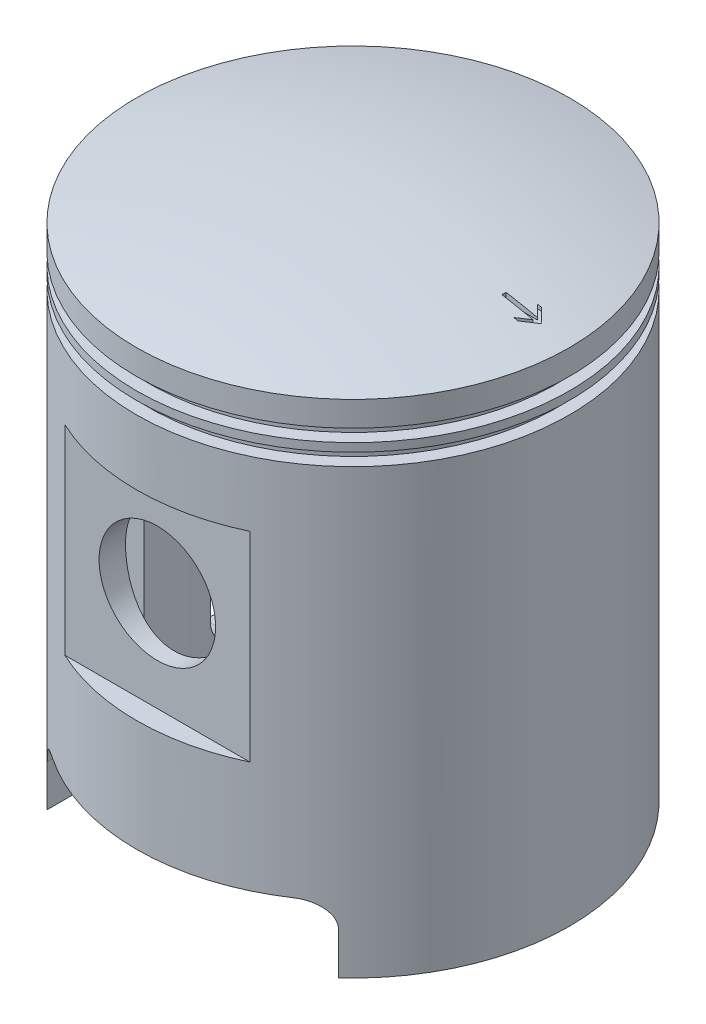
from build123d import *

# Parameters (mm, degrees)
SKETCH_1_R          = 26
EXTRUDE_1_DEPTH     = 60.2
SKETCH_3_R          = 7
CUT_EXTRUDE_1_DEPTH = 30.1
SKETCH_4_R          = 21.5
CUT_EXTRUDE_2_DEPTH = 51
SKETCH_5_W          = 1.5
SKETCH_5_H          = 1.5
CUT_EXTRUDE_3_DEPTH = 50
SKETCH_9_W          = 5.5
SKETCH_9_H          = 24
CUT_EXTRUDE_4_DEPTH = 25
CUT_EXTRUDE_5_DEPTH = 2.1


with BuildPart() as part:
    # Эскиз1 → Бобышка-Вытянуть1 (new body)
    with BuildSketch(Plane(origin=(0, 0, 0), x_dir=(1, 0, 0), z_dir=(0, 1, 0))):
        with Locations(Location((0, 0, 0), (0, 0, 270))):
            Circle(SKETCH_1_R)
    extrude(amount=EXTRUDE_1_DEPTH)

    # Эскиз2 → Повернуть1 (revolve)
    with BuildSketch(Plane.XY):
        with BuildLine():
            Line((26, 60.2), (0, 60.2))
            Line((0, 60.2), (0, 63.5))
            ThreePointArc((0, 63.5), (13.10429319, 62.671703918), (26, 60.2))
        make_face()
    revolve(axis=Axis((0, 60.2, 0), (0, 1, 0)))

    # Эскиз3 → Вырез-Вытянуть1 (cut, symmetric)
    with BuildSketch(Plane.XY):
        with Locations((0, 33.4)):
            Circle(SKETCH_3_R)
        with BuildLine():
            Line((17.5, 0), (-17.5, 0))
            Line((-17.5, 0), (-17.5, 5))
            ThreePointArc((-17.5, 5), (-16.621320344, 7.121320344), (-14.5, 8))
            Line((-14.5, 8), (14.5, 8))
            ThreePointArc((14.5, 8), (16.621320344, 7.121320344), (17.5, 5))
            Line((17.5, 5), (17.5, 0))
        make_face()
    extrude(amount=CUT_EXTRUDE_1_DEPTH, both=True, mode=Mode.SUBTRACT)

    # Эскиз4 → Вырез-Вытянуть2 (cut)
    with BuildSketch(Plane(origin=(0, 0, 0), x_dir=(1, 0, 0), z_dir=(0, 1, 0))):
        with Locations(Location((0, 0, 0), (0, 0, 47.590982222))):
            Circle(SKETCH_4_R)
    extrude(amount=CUT_EXTRUDE_2_DEPTH, mode=Mode.SUBTRACT)

    # Эскиз5 → Вырез-Повернуть1 (revolve, cut)
    with BuildSketch(Plane.XY, mode=Mode.PRIVATE) as cut_revolve_1_sk:
        with Locations((-25.25, 56.45)):
            Rectangle(SKETCH_5_W, SKETCH_5_H)
        with Locations((-25.25, 53.95)):
            Rectangle(SKETCH_5_W, SKETCH_5_H)
    revolve(cut_revolve_1_sk.sketch.rotate(Axis((0, 37.032198444, 0), (0, 1, 0)), 270), axis=Axis((0, 37.032198444, 0), (0, 1, 0)), mode=Mode.SUBTRACT)

    # Эскиз6 → Вырез-Вытянуть3 (cut)
    with BuildSketch(Plane(origin=(0, 0, 0), x_dir=(0, 0, -1), z_dir=(1, 0, 0))):
        with BuildLine():
            Line((-4, 6), (-4, 25))
            ThreePointArc((-4, 25), (-4.878679656, 27.121320344), (-7, 28))
            Line((-7, 28), (-10, 28))
            ThreePointArc((-10, 28), (-12.121320344, 27.121320344), (-13, 25))
            Line((-13, 25), (-13, 6))
            ThreePointArc((-13, 6), (-12.121320344, 3.878679656), (-10, 3))
            Line((-10, 3), (-7, 3))
            ThreePointArc((-7, 3), (-4.878679656, 3.878679656), (-4, 6))
        make_face()
        with BuildLine():
            Line((10, 3), (7, 3))
            ThreePointArc((7, 3), (4.878679656, 3.878679656), (4, 6))
            Line((4, 6), (4, 25))
            ThreePointArc((4, 25), (4.878679656, 27.121320344), (7, 28))
            Line((7, 28), (10, 28))
            ThreePointArc((10, 28), (12.121320344, 27.121320344), (13, 25))
            Line((13, 25), (13, 6))
            ThreePointArc((13, 6), (12.121320344, 3.878679656), (10, 3))
        make_face()
    extrude(amount=-CUT_EXTRUDE_3_DEPTH, mode=Mode.SUBTRACT)

    # Эскиз9 → Вырез-Вытянуть4 (cut, symmetric)
    with BuildSketch(Plane(origin=(0, 0, 0), x_dir=(0, 0, -1), z_dir=(1, 0, 0))):
        with Locations((-26.254259625, 33.4)):
            Rectangle(SKETCH_9_W, SKETCH_9_H)
        with Locations((26.254259625, 33.4)):
            Rectangle(SKETCH_9_W, SKETCH_9_H)
    extrude(amount=CUT_EXTRUDE_4_DEPTH, both=True, mode=Mode.SUBTRACT)

    # Эскиз10 → Вырез-Вытянуть5 (cut)
    with BuildSketch(Plane(origin=(0, 63, 0), x_dir=(1, 0, 0), z_dir=(0, 1, 0))):
        Polygon((22.641485295, 0), (21.227271732, 1.414213562), (20.727271732, 1.414213562), (21.891485295, 0.25), (18.141485295, 0.25), (18.141485295, -0.25), (21.891485295, -0.25), (20.727271732, -1.414213562), (21.227271732, -1.414213562), align=None)
    extrude(amount=-CUT_EXTRUDE_5_DEPTH, mode=Mode.SUBTRACT)


solid = part.part
